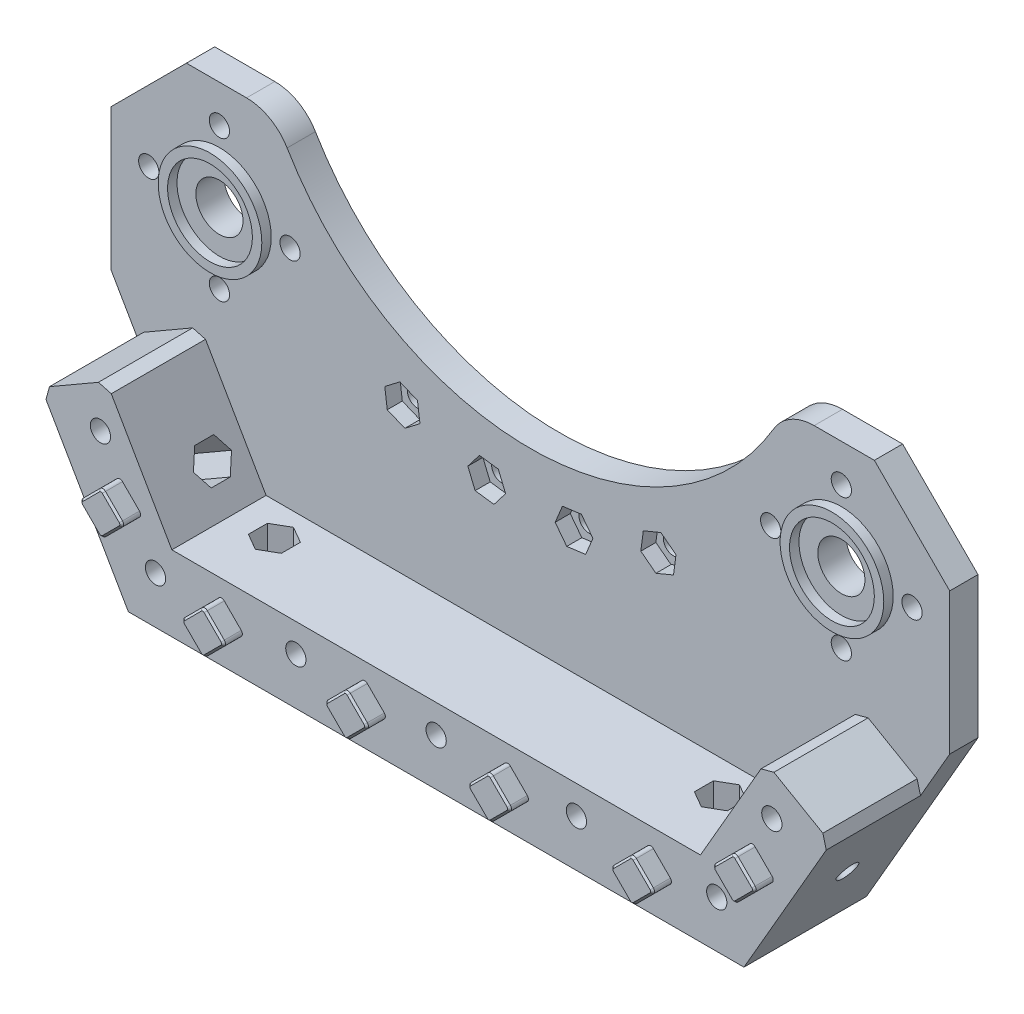
from build123d import *

# Parameters (mm, degrees)
SKETCH1_R           = 4.9999999999999964
SKETCH1_R_2         = 5.000000000000004
BOSS_EXTRUDE1_DEPTH = 6
BOSS_EXTRUDE2_DEPTH = 20
SKETCH4_R           = 2.1500000000000012
SKETCH4_R_2         = 2.150000000000001
CUT_EXTRUDE1_DEPTH  = 112.43159336561604
SKETCH5_R           = 2.150000000000001
SKETCH5_R_2         = 2.1499999999999972
SKETCH5_R_3         = 2.1500000000000044
SKETCH5_R_4         = 2.1499999999999995
CUT_EXTRUDE2_DEPTH  = 113.66321493726336
SKETCH6_R           = 10.999999999999993
SKETCH6_R_2         = 9.000000000000004
SKETCH6_R_3         = 8.999999999999996
BOSS_EXTRUDE4_DEPTH = 2
CUT_EXTRUDE3_START  = -7
SKETCH7_R           = 4.500000000000005
SKETCH7_R_2         = 4.499999999999997
SKETCH7_R_3         = 4.500000000000003
SKETCH7_R_4         = 4.499999999999999
CUT_EXTRUDE3_DEPTH  = 106.66321493726336
BOSS_EXTRUDE5_DEPTH = 4
FILLET1_R           = 0.8
CHAMFER1_SIZE       = 0.4
SKETCH9_R           = 60
CUT_EXTRUDE4_DEPTH  = 113.2185367931698
SKETCH10_R          = 2.1499999999999972
SKETCH10_R_2        = 2.150000000000001
CUT_EXTRUDE5_DEPTH  = 114.65298060323805
CUT_EXTRUDE6_DEPTH  = 3.2
CUT_EXTRUDE7_DEPTH  = 182.34845465192208
CUT_EXTRUDE8_DEPTH  = 129.02343535462563
CUT_EXTRUDE9_START  = -5
CUT_EXTRUDE9_DEPTH  = 177.34845465192208
CUT_EXTRUDE10_START = -5
CUT_EXTRUDE10_DEPTH = 124.02343535462563
CHAMFER2_SIZE       = 2
CHAMFER3_SIZE       = 16
FILLET2_R           = 10


with BuildPart() as part:
    # Sketch1 → Boss-Extrude1 (new body)
    with BuildSketch(Plane.XY):
        Polygon((-65.32863896322534, -64), (65.32863896322536, -64), (88.99999999999999, -22.999999999999975), (88.99999999999999, 23.000000000000025), (42.999999999999986, 23.000000000000018), (-43, 23), (-89, 22.999999999999993), (-89, -23), align=None)
        with Locations((-66, 0)):
            Circle(SKETCH1_R, mode=Mode.SUBTRACT)
        with Locations((66, 1.355e-14)):
            Circle(SKETCH1_R_2, mode=Mode.SUBTRACT)
    extrude(amount=BOSS_EXTRUDE1_DEPTH)

    # Sketch2 → Boss-Extrude2 (add)
    with BuildSketch(Plane.XY.offset(6)):
        Polygon((-83.80384757729335, -32), (-65.32863896322534, -64), (65.32863896322536, -64), (83.80384757729338, -32), (69.94744111674235, -23.999999999999993), (56.09103465619134, -48), (-56.091034656191326, -48), (-69.94744111674234, -24), align=None)
    extrude(amount=BOSS_EXTRUDE2_DEPTH)

    # Sketch4 → Cut-Extrude1 (cut, through all)
    with BuildSketch(Plane.XY.offset(6)):
        with Locations((-81, 0)):
            Circle(SKETCH4_R)
        with Locations((-66.00000000000001, 15)):
            Circle(SKETCH4_R_2)
        with Locations((-51.00000000000001, 5.51e-15)):
            Circle(SKETCH4_R)
        with Locations((-66, -15)):
            Circle(SKETCH4_R_2)
        with Locations((51.00000000000001, 0)):
            Circle(SKETCH4_R)
        with Locations((65.99999999999999, 15)):
            Circle(SKETCH4_R_2)
        with Locations((81, 5.51e-15)):
            Circle(SKETCH4_R)
        with Locations((66, -15)):
            Circle(SKETCH4_R_2)
    extrude(amount=-CUT_EXTRUDE1_DEPTH, mode=Mode.SUBTRACT)

    # Sketch5 → Cut-Extrude2 (cut, through all)
    with BuildSketch(Plane.XY.offset(26.000000000000004)):
        with Locations((-71.24647922241898, -33.74999999999999)):
            Circle(SKETCH5_R)
        with Locations((-59.555136271329076, -53.99999999999999)):
            Circle(SKETCH5_R)
        with Locations((-29.77756813566454, -53.99999999999999)):
            Circle(SKETCH5_R_2)
        with Locations((29.77756813566454, -53.99999999999999)):
            Circle(SKETCH5_R_3)
        with Locations((71.246479222419, -33.749999999999986)):
            Circle(SKETCH5_R)
        with Locations((3.51e-15, -54)):
            Circle(SKETCH5_R_4)
        with Locations((59.55513627132908, -53.99999999999999)):
            Circle(SKETCH5_R)
    extrude(amount=-CUT_EXTRUDE2_DEPTH, mode=Mode.SUBTRACT)

    # Sketch6 → Boss-Extrude4 (add)
    # profile 1 of 2: a face of its own
    with BuildSketch(Plane.XY.offset(6)):
        with Locations((-66, 0)):
            Circle(SKETCH6_R)
        with Locations((-66, 0)):
            Circle(SKETCH6_R_2, mode=Mode.SUBTRACT)
    # profile 2 of 2: a face of its own
    with BuildSketch(Plane.XY.offset(6)):
        with Locations((66, 1.355e-14)):
            Circle(SKETCH6_R)
        with Locations((66, 1.355e-14)):
            Circle(SKETCH6_R_3, mode=Mode.SUBTRACT)
    extrude(amount=BOSS_EXTRUDE4_DEPTH)

    # Sketch7 → Cut-Extrude3 (cut, through all)
    with BuildSketch(Plane.XY.offset(26.000000000000004).offset(CUT_EXTRUDE3_START)):
        with Locations((-71.24647922241898, -33.74999999999999)):
            Circle(SKETCH7_R)
        with Locations((-59.555136271329076, -53.99999999999999)):
            Circle(SKETCH7_R_2)
        with Locations((-29.77756813566454, -53.99999999999999)):
            Circle(SKETCH7_R_3)
        with Locations((3.51e-15, -54)):
            Circle(SKETCH7_R_4)
        with Locations((29.77756813566454, -53.99999999999999)):
            Circle(SKETCH7_R_3)
        with Locations((59.55513627132908, -53.99999999999999)):
            Circle(SKETCH7_R_2)
        with Locations((71.246479222419, -33.749999999999986)):
            Circle(SKETCH7_R)
    extrude(amount=-CUT_EXTRUDE3_DEPTH, mode=Mode.SUBTRACT)

    # Sketch8 → Boss-Extrude5 (add)
    with BuildSketch(Plane.XY.offset(26.000000000000004)):
        Polygon((-62.395243120493035, -44.87500000000001), (-67.13285855444289, -40.137384566050144), (-71.87047398839276, -44.87500000000001), (-67.1328585544429, -49.61261543394988), align=None)
        Polygon((-50.26999304123107, -55.99999999999999), (-45.53237760728124, -51.26238456605012), (-40.79476217333134, -55.99999999999999), (-45.53237760728124, -60.73761543394986), align=None)
        Polygon((-19.915074636376925, -55.99999999999999), (-15.17745920242707, -51.26238456605014), (-10.439843768477186, -55.99999999999999), (-15.17745920242707, -60.73761543394987), align=None)
        Polygon((10.439843768477319, -55.99999999999999), (15.177459202427096, -60.73761543394988), (19.915074636377103, -56), (15.177459202427096, -51.26238456605013), align=None)
        Polygon((50.269993041231146, -55.99999999999999), (45.532377607281255, -51.26238456605019), (40.79476217333143, -55.99999999999999), (45.532377607281276, -60.73761543394991), align=None)
        Polygon((62.395243120493014, -44.875), (67.1328585544429, -49.612615433949856), (71.87047398839272, -44.87500000000001), (67.13285855444289, -40.13738456605014), align=None)
    extrude(amount=BOSS_EXTRUDE5_DEPTH)

    # Fillet1
    fillet1_edges = [part.edges().sort_by_distance(p)[0] for p in [
        (67.13285855444289, -40.13738456605014, 28.000000000000004),
        (71.87047398839272, -44.87500000000001, 28.000000000000004),
        (67.1328585544429, -49.612615433949856, 28.000000000000004),
        (62.395243120493014, -44.875, 28.000000000000004),
        (50.269993041231146, -55.99999999999999, 28.000000000000004),
        (45.532377607281255, -51.26238456605019, 28.000000000000004),
        (40.79476217333143, -55.99999999999999, 28.000000000000004),
        (45.532377607281276, -60.73761543394991, 28.000000000000004),
        (19.915074636377103, -56, 28.000000000000004),
        (15.177459202427096, -51.26238456605013, 28.000000000000004),
        (15.177459202427096, -60.73761543394988, 28.000000000000004),
        (10.439843768477319, -55.99999999999999, 28.000000000000004),
        (-15.17745920242707, -51.26238456605014, 28.000000000000004),
        (-19.915074636376925, -55.99999999999999, 28.000000000000004),
        (-10.439843768477186, -55.99999999999999, 28.000000000000004),
        (-15.17745920242707, -60.73761543394987, 28.000000000000004),
        (-45.53237760728124, -60.73761543394986, 28.000000000000004),
        (-40.79476217333134, -55.99999999999999, 28.000000000000004),
        (-45.53237760728124, -51.26238456605012, 28.000000000000004),
        (-50.26999304123107, -55.99999999999999, 28.000000000000004),
        (-62.395243120493035, -44.87500000000001, 28.000000000000004),
        (-67.1328585544429, -49.61261543394988, 28.000000000000004),
        (-67.13285855444289, -40.137384566050144, 28.000000000000004),
        (-71.87047398839276, -44.87500000000001, 28.000000000000004),
    ]]
    fillet(fillet1_edges, radius=FILLET1_R)

    # Chamfer1
    chamfer1_edges = [part.edges().sort_by_distance(p)[0] for p in [
        (-67.1328585544429, -49.2812445840514, 30.000000000000004),
        (-69.50166627141783, -47.24380771697494, 30.000000000000004),
        (-71.53910313849428, -44.87499999999999, 30.000000000000004),
        (-69.50166627141782, -42.50619228302507, 30.000000000000004),
        (-67.13285855444289, -40.46875541594862, 30.000000000000004),
        (-64.76405083746796, -42.50619228302507, 30.000000000000004),
        (-62.72661397039151, -44.87500000000001, 30.000000000000004),
        (-64.76405083746798, -47.24380771697494, 30.000000000000004),
        (-49.9386221913326, -56, 30.000000000000004),
        (-47.90118532425616, -53.631192283025065, 30.000000000000004),
        (-45.53237760728123, -51.59375541594861, 30.000000000000004),
        (-43.163569890306285, -53.631192283025065, 30.000000000000004),
        (-41.126133023229826, -55.99999999999999, 30.000000000000004),
        (-43.16356989030629, -58.36880771697493, 30.000000000000004),
        (-45.53237760728124, -60.40624458405139, 30.000000000000004),
        (-47.901185324256154, -58.36880771697493, 30.000000000000004),
        (-10.771214618375662, -55.99999999999999, 30.000000000000004),
        (-12.808651485452126, -58.36880771697493, 30.000000000000004),
        (-15.177459202427066, -60.40624458405139, 30.000000000000004),
        (-17.546266919401994, -58.368807716974935, 30.000000000000004),
        (-19.58370378647845, -55.99999999999999, 30.000000000000004),
        (-17.546266919401997, -53.631192283025065, 30.000000000000004),
        (-15.177459202427064, -51.59375541594862, 30.000000000000004),
        (-12.808651485452126, -53.631192283025065, 30.000000000000004),
        (15.177459202427103, -60.40624458405141, 30.000000000000004),
        (12.808651485452204, -58.36880771697493, 30.000000000000004),
        (10.771214618375781, -55.99999999999999, 30.000000000000004),
        (12.808651485452202, -53.631192283025065, 30.000000000000004),
        (15.177459202427098, -51.59375541594861, 30.000000000000004),
        (17.54626691940209, -53.63119228302506, 30.000000000000004),
        (19.58370378647861, -56, 30.000000000000004),
        (17.54626691940209, -58.36880771697495, 30.000000000000004),
        (45.532377607281276, -60.40624458405143, 30.000000000000004),
        (43.16356989030635, -58.36880771697495, 30.000000000000004),
        (41.126133023229904, -56, 30.000000000000004),
        (43.16356989030635, -53.63119228302509, 30.000000000000004),
        (45.53237760728126, -51.59375541594866, 30.000000000000004),
        (47.9011853242562, -53.63119228302509, 30.000000000000004),
        (49.93862219133266, -55.99999999999999, 30.000000000000004),
        (47.90118532425621, -58.36880771697495, 30.000000000000004),
        (71.53910313849424, -44.87500000000001, 30.000000000000004),
        (69.5016662714178, -47.243807716974935, 30.000000000000004),
        (67.1328585544429, -49.28124458405138, 30.000000000000004),
        (64.76405083746796, -47.24380771697493, 30.000000000000004),
        (62.7266139703915, -44.875, 30.000000000000004),
        (64.76405083746795, -42.506192283025065, 30.000000000000004),
        (67.13285855444289, -40.46875541594862, 30.000000000000004),
        (69.5016662714178, -42.50619228302508, 30.000000000000004),
    ]]
    chamfer(chamfer1_edges, length=CHAMFER1_SIZE)

    # Sketch9 → Cut-Extrude4 (cut, through all)
    with BuildSketch(Plane.XY.offset(6)):
        with Locations((0, 48.66)):
            Circle(SKETCH9_R)
    extrude(amount=-CUT_EXTRUDE4_DEPTH, mode=Mode.SUBTRACT)

    # Sketch10 → Cut-Extrude5 (cut, through all)
    with BuildSketch(Plane(origin=(0, 0, 0), x_dir=(-1, 0, 0), z_dir=(0, 0, -1))):
        with Locations((-27.17052369792071, -16.935446808301627)):
            Circle(SKETCH10_R)
        with Locations((-9.267359647623417, -21.732585157540576)):
            Circle(SKETCH10_R_2)
        with Locations((9.267359647623424, -21.732585157540573)):
            Circle(SKETCH10_R)
        with Locations((27.17052369792075, -16.935446808301613)):
            Circle(SKETCH10_R)
    extrude(amount=-CUT_EXTRUDE5_DEPTH, mode=Mode.SUBTRACT)

    # Sketch11 → Cut-Extrude6 (cut)
    with BuildSketch(Plane.XY.offset(6)):
        Polygon((-27.698039023422588, -12.928570105095728), (-30.904338375480005, -15.388850129468889), (-30.376823049978167, -19.395726832674786), (-26.643008372418922, -20.942323511507514), (-23.436709020361505, -18.48204348713435), (-23.964224345863343, -14.475166783928453), align=None)
        Polygon((-10.813956326456324, -17.998770479981292), (-13.274236350829405, -21.205069832038856), (-11.727639671996478, -24.938884509598214), (-7.720762968790577, -25.466399835099907), (-5.260482944417441, -22.26010048304227), (-6.807079623250332, -18.526285805482992), align=None)
        Polygon((6.807079623250327, -18.526285805483113), (5.260482944417526, -22.260100483042336), (7.720762968790616, -25.466399835099804), (11.72763967199651, -24.938884509598036), (13.274236350829312, -21.205069832038813), (10.813956326456223, -17.99877047998135), align=None)
        Polygon((23.964224345863304, -14.475166783928472), (23.43670902036146, -18.482043487134348), (26.643008372418862, -20.942323511507507), (30.376823049978114, -19.395726832674786), (30.90433837547996, -15.3888501294689), (27.698039023422563, -12.928570105095748), align=None)
    extrude(amount=-CUT_EXTRUDE6_DEPTH, mode=Mode.SUBTRACT)

    # Sketch12 → Cut-Extrude7 (cut, through all)
    with BuildSketch(Plane(origin=(-76.70929214352107, -44.28813046840753, 0), x_dir=(0, 0, 1), z_dir=(-0.8660254037844386, -0.5, 0))):
        with BuildLine():
            Line((14.86195461813655, -3.6863063605914035), (15.482606157515399, -4.761306360591408))
            Line((15.482606157515399, -4.761306360591408), (14.861954618136547, -5.836306360591412))
            ThreePointArc((14.861954618136547, -5.836306360591412), (10.850000000000005, -4.761306360591407), (14.86195461813655, -3.6863063605914035))
        make_face()
    cut_extrude7 = extrude(amount=-CUT_EXTRUDE7_DEPTH, mode=Mode.SUBTRACT)

    # Sketch13 → Cut-Extrude8 (cut, through all)
    with BuildSketch(Plane.XZ.offset(64)):
        with BuildLine():
            Line((-48.40363896322535, 14.861954618136547), (-47.328638963225345, 15.482606157515402))
            Line((-47.328638963225345, 15.482606157515402), (-46.25363896322535, 14.86195461813656))
            ThreePointArc((-46.25363896322535, 14.86195461813656), (-47.32863896322534, 10.850000000000012), (-48.40363896322535, 14.861954618136547))
        make_face()
    cut_extrude8 = extrude(amount=-CUT_EXTRUDE8_DEPTH, mode=Mode.SUBTRACT)

    # Sketch14 → Cut-Extrude9 (cut, through all)
    with BuildSketch(Plane(origin=(-76.70929214352103, -44.28813046840751, 0), x_dir=(0, 0, 1), z_dir=(-0.8660254037844387, -0.5000000000000001, 0)).offset(CUT_EXTRUDE9_START)):
        Polygon((17.041451884327383, -4.761306360591389), (15.020725942163693, -1.2613063605913877), (10.979274057836317, -1.2613063605913881), (8.958548115672627, -4.761306360591388), (10.979274057836319, -8.261306360591387), (15.020725942163697, -8.261306360591387), align=None)
    cut_extrude9 = extrude(amount=-CUT_EXTRUDE9_DEPTH, mode=Mode.SUBTRACT)

    # Sketch15 → Cut-Extrude10 (cut, through all)
    with BuildSketch(Plane.XZ.offset(64).offset(CUT_EXTRUDE10_START)):
        Polygon((-47.328638963225345, 17.04145188432739), (-50.828638963225345, 15.020725942163702), (-50.828638963225345, 10.97927405783631), (-47.32863896322534, 8.958548115672619), (-43.82863896322534, 10.979274057836312), (-43.82863896322534, 15.020725942163693), align=None)
    cut_extrude10 = extrude(amount=-CUT_EXTRUDE10_DEPTH, mode=Mode.SUBTRACT)

    # Mirror1: Cut-Extrude7, Cut-Extrude8, Cut-Extrude9, Cut-Extrude10 across plane
    add(cut_extrude7.mirror(Plane(origin=(0, 0, 0), x_dir=(0, 0, 1), z_dir=(1, 0, 0))), mode=Mode.SUBTRACT)
    add(cut_extrude8.mirror(Plane(origin=(0, 0, 0), x_dir=(0, 0, 1), z_dir=(1, 0, 0))), mode=Mode.SUBTRACT)
    add(cut_extrude9.mirror(Plane(origin=(0, 0, 0), x_dir=(0, 0, 1), z_dir=(1, 0, 0))), mode=Mode.SUBTRACT)
    add(cut_extrude10.mirror(Plane(origin=(0, 0, 0), x_dir=(0, 0, 1), z_dir=(1, 0, 0))), mode=Mode.SUBTRACT)

    # Chamfer2
    chamfer2_edges = [part.edges().sort_by_distance(p)[0] for p in [
        (83.80384757729338, -32, 16),
        (69.94744111674235, -23.999999999999993, 16),
        (-83.80384757729335, -32, 16),
        (-69.94744111674234, -24, 16),
    ]]
    chamfer(chamfer2_edges, length=CHAMFER2_SIZE)

    # Chamfer3
    chamfer3_edges = [part.edges().sort_by_distance(p)[0] for p in [
        (88.99999999999999, 23.000000000000025, 3),
        (-89, 22.999999999999993, 3),
    ]]
    chamfer(chamfer3_edges, length=CHAMFER3_SIZE)

    # Fillet2
    fillet2_edges = [part.edges().sort_by_distance(p)[0] for p in [
        (-54.236190869197294, 23.000000000000004, 3),
        (54.23619086919731, 23.000000000000018, 3),
    ]]
    fillet(fillet2_edges, radius=FILLET2_R)


solid = part.part
